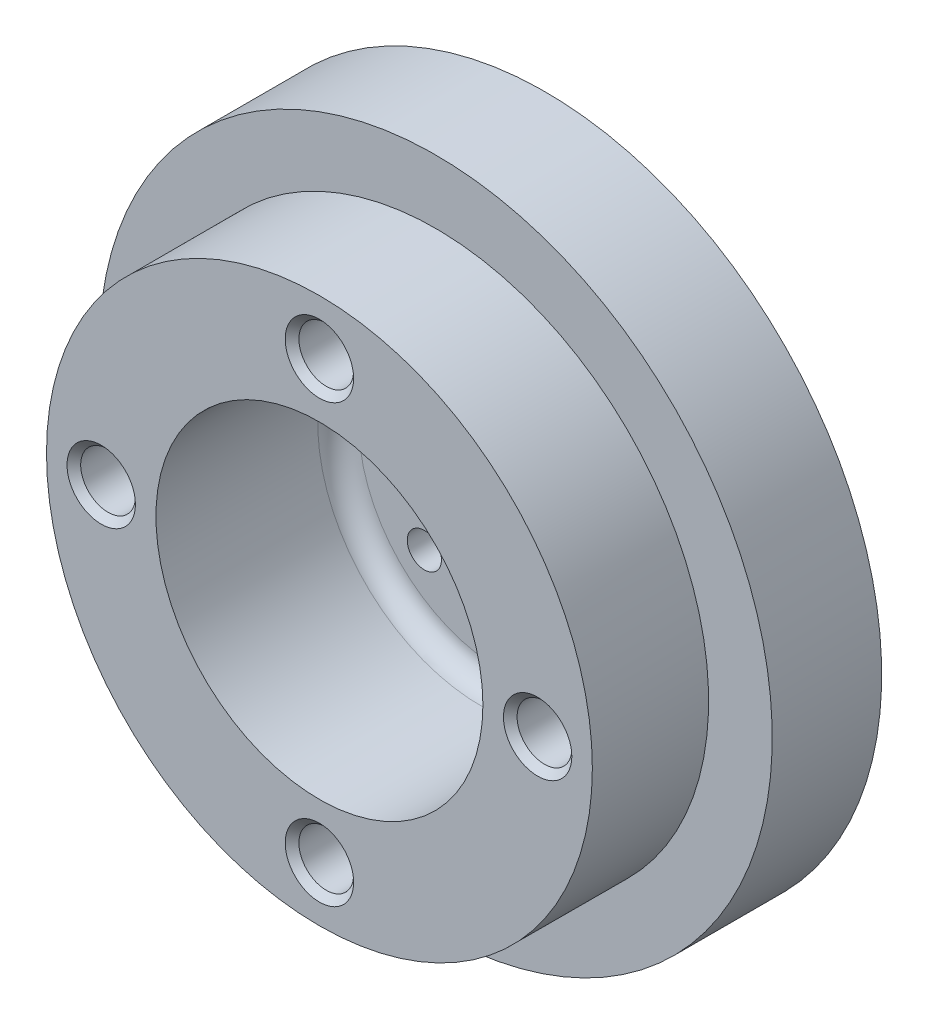
from build123d import *

# Parameters (mm, degrees)
SKETCH1_R           = 19.75
SKETCH1_R_2         = 4.2
SKETCH1_R_3         = 1.25
BOSS_EXTRUDE1_DEPTH = 3.175
SKETCH3_R           = 19.95
SKETCH3_R_2         = 11.95
BOSS_EXTRUDE2_DEPTH = 13.325
SKETCH4_R           = 2
CUT_EXTRUDE1_DEPTH  = 42.12243913
CIRPATTERN1_COUNT   = 4
SKETCH5_R           = 24.6
SKETCH5_R_2         = 19.75
BOSS_EXTRUDE3_DEPTH = 8
CHAMFER1_SIZE       = 0.5
FILLET1_R           = 1.5


with BuildPart() as part:
    # Sketch1 → Boss-Extrude1 (new body)
    with BuildSketch(Plane.XY):
        with Locations((0, 12)):
            Circle(SKETCH1_R)
        with Locations((0, 12)):
            Circle(SKETCH1_R_2, mode=Mode.SUBTRACT)
        with Locations((5.656854249, 17.656854249)):
            Circle(SKETCH1_R_3, mode=Mode.SUBTRACT)
        with Locations((8, 12)):
            Circle(SKETCH1_R_3, mode=Mode.SUBTRACT)
        with Locations((5.656854249, 6.343145751)):
            Circle(SKETCH1_R_3, mode=Mode.SUBTRACT)
        with Locations((0, 4)):
            Circle(SKETCH1_R_3, mode=Mode.SUBTRACT)
        with Locations((-5.656854249, 6.343145751)):
            Circle(SKETCH1_R_3, mode=Mode.SUBTRACT)
        with Locations((-8, 12)):
            Circle(SKETCH1_R_3, mode=Mode.SUBTRACT)
        with Locations((-5.656854249, 17.656854249)):
            Circle(SKETCH1_R_3, mode=Mode.SUBTRACT)
        with Locations((0, 20)):
            Circle(SKETCH1_R_3, mode=Mode.SUBTRACT)
    extrude(amount=BOSS_EXTRUDE1_DEPTH)

    # Sketch3 → Boss-Extrude2 (add)
    with BuildSketch(Plane.XY.offset(3.175)):
        with Locations((0, 12)):
            Circle(SKETCH3_R)
        with Locations((0, 12)):
            Circle(SKETCH3_R_2, mode=Mode.SUBTRACT)
    extrude(amount=BOSS_EXTRUDE2_DEPTH)

    # Sketch4 → Cut-Extrude1 (cut, through all)
    with BuildSketch(Plane.XY.offset(16.5)):
        with Locations((-15.95, 12)):
            Circle(SKETCH4_R)
    cut_extrude1 = extrude(amount=-CUT_EXTRUDE1_DEPTH, mode=Mode.SUBTRACT)

    # CirPattern1: Cut-Extrude1 ×4 about axis
    cirpattern1_axis = Axis((0, 12, 0), (0, 0, 1))
    for i in range(1, CIRPATTERN1_COUNT):
        add(cut_extrude1.rotate(cirpattern1_axis, i * 360 / CIRPATTERN1_COUNT), mode=Mode.SUBTRACT)

    # Sketch5 → Boss-Extrude3 (add)
    with BuildSketch(Plane(origin=(0, 0, 0), x_dir=(-1, 0, 0), z_dir=(0, 0, -1))):
        with Locations((0, 12)):
            Circle(SKETCH5_R)
        with Locations((0, 12)):
            Circle(SKETCH5_R_2, mode=Mode.SUBTRACT)
    extrude(amount=-BOSS_EXTRUDE3_DEPTH)

    # Chamfer1
    chamfer1_edges = [part.edges().sort_by_distance(p)[0] for p in [
        (-17.95, 12, 16.5),
        (0, -5.95, 16.5),
        (17.95, 12, 16.5),
        (0, 29.95, 16.5),
    ]]
    chamfer(chamfer1_edges, length=CHAMFER1_SIZE)

    # Fillet1
    fillet1_edges = [part.edges().sort_by_distance(p)[0] for p in [
        (-11.95, 12, 3.175),
    ]]
    fillet(fillet1_edges, radius=FILLET1_R)


solid = part.part
